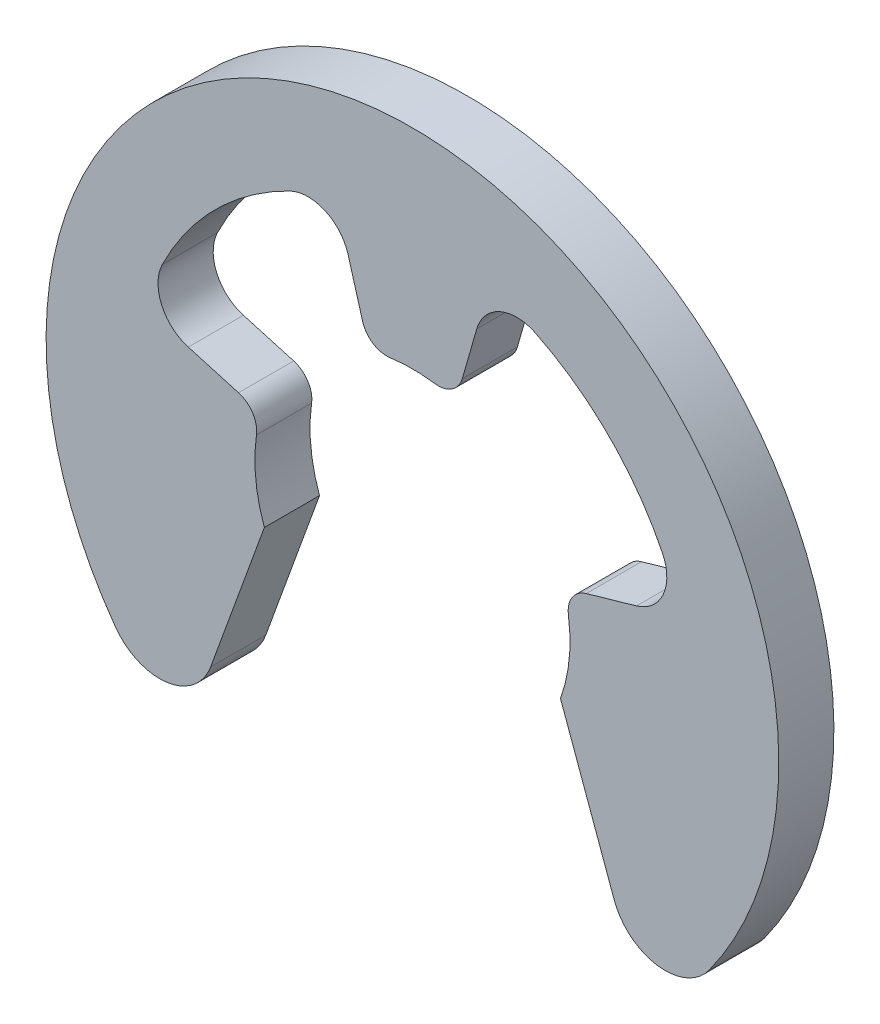
from build123d import *

# Parameters (mm, degrees)
BOSS_EXTRU_1_DEPTH = 0.7


with BuildPart() as part:
    # Esquisse1 → Boss.-Extru.1 (new body)
    with BuildSketch(Plane.XY.offset(0.7)):
        with BuildLine():
            Line((0.632886418, 2.207137237), (0.815865574, 2.845261388))
            ThreePointArc((0.815865574, 2.845261388), (1.110405111, 3.18363768), (1.558931601, 3.174917521))
            ThreePointArc((1.558931601, 3.174917521), (2.501036685, 2.501036685), (3.174917521, 1.558931601))
            ThreePointArc((3.174917521, 1.558931601), (3.18363768, 1.110405111), (2.845261388, 0.815865574))
            Line((2.845261388, 0.815865574), (2.207137237, 0.632886418))
            ThreePointArc((2.207137237, 0.632886418), (2.027919172, 0.500132947), (1.979974043, 0.282316824))
            ThreePointArc((1.979974043, 0.282316824), (1.989252382, -0.2070627), (1.879385242, -0.684040287))
            Line((1.879385242, -0.684040287), (2.561408424, -2.557883579))
            ThreePointArc((2.561408424, -2.557883579), (3.113603209, -3.004615598), (3.76702433, -2.726174553))
            ThreePointArc((3.76702433, -2.726174553), (0, 4.65), (-3.76702433, -2.726174553))
            ThreePointArc((-3.76702433, -2.726174553), (-3.113603209, -3.004615598), (-2.561408424, -2.557883579))
            Line((-2.561408424, -2.557883579), (-1.879385242, -0.684040287))
            ThreePointArc((-1.879385242, -0.684040287), (-1.989252382, -0.2070627), (-1.979974043, 0.282316824))
            ThreePointArc((-1.979974043, 0.282316824), (-2.027919172, 0.500132947), (-2.207137237, 0.632886418))
            Line((-2.207137237, 0.632886418), (-2.845261388, 0.815865574))
            ThreePointArc((-2.845261388, 0.815865574), (-3.18363768, 1.110405111), (-3.174917521, 1.558931601))
            ThreePointArc((-3.174917521, 1.558931601), (-2.501036685, 2.501036685), (-1.558931601, 3.174917521))
            ThreePointArc((-1.558931601, 3.174917521), (-1.110405111, 3.18363768), (-0.815865574, 2.845261388))
            Line((-0.815865574, 2.845261388), (-0.632886418, 2.207137237))
            ThreePointArc((-0.632886418, 2.207137237), (-0.500132947, 2.027919172), (-0.282316824, 1.979974043))
            ThreePointArc((-0.282316824, 1.979974043), (0, 2), (0.282316824, 1.979974043))
            ThreePointArc((0.282316824, 1.979974043), (0.500132947, 2.027919172), (0.632886418, 2.207137237))
        make_face()
    extrude(amount=-BOSS_EXTRU_1_DEPTH)


solid = part.part
